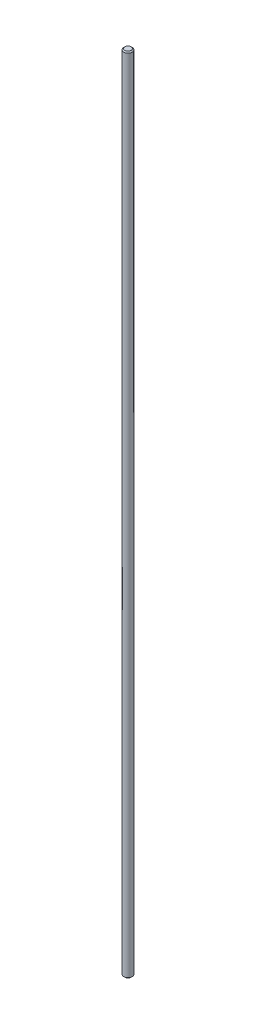
from build123d import *

# Parameters (mm, degrees)
SKETCH_1_R      = 4
EXTRUDE_1_DEPTH = 770
CHAMFER_1_SIZE  = 1


with BuildPart() as part:
    # 草图1 → 凸台-拉伸1 (new body)
    with BuildSketch(Plane(origin=(0, 0, 0), x_dir=(1, 0, 0), z_dir=(0, 1, 0))):
        with Locations(Location((0, 0, 0), (0, 0, 270))):
            Circle(SKETCH_1_R)
    extrude(amount=EXTRUDE_1_DEPTH)

    # 倒角1
    chamfer_1_edges = [part.edges().sort_by_distance(p)[0] for p in [
        (0, 0, -4),
        (0, 770, -4),
    ]]
    chamfer(chamfer_1_edges, length=CHAMFER_1_SIZE)


solid = part.part
